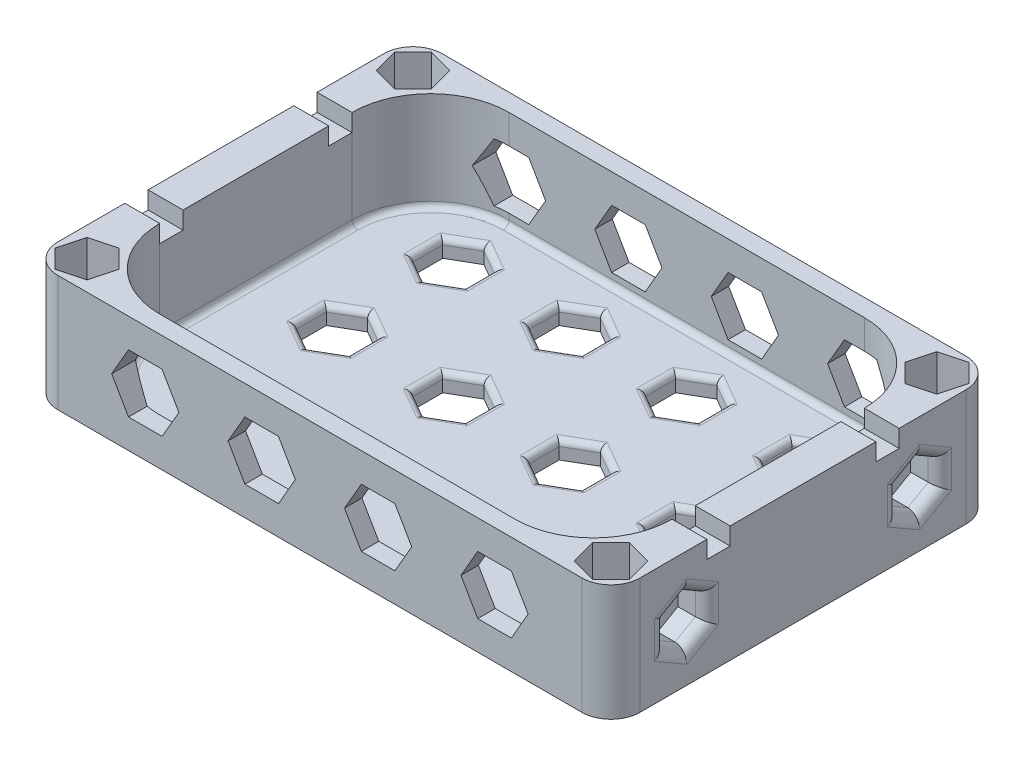
from build123d import *

# Parameters (mm, degrees)
BOSS_EXTRUDE7_DEPTH     = 20
BOSS_EXTRUDE9_DEPTH     = 3
CUT_EXTRUDE1_DEPTH      = 5
CUT_EXTRUDE2_DEPTH      = 5
FILLET3_R               = 2
FILLET4_R               = 1
SKETCH7_W               = 6
SKETCH7_H               = 4
CUT_EXTRUDE3_DEPTH      = 3
CUT_EXTRUDE4_DEPTH      = 122.474277112
CUT_EXTRUDE4_DEPTH_BACK = 122.474277112


with BuildPart() as part:
    # Sketch3 → Boss-Extrude7 (new body)
    with BuildSketch(Plane.XZ):
        with BuildLine():
            ThreePointArc((0, -28), (-1.464466094, -24.464466094), (-5, -23))
            ThreePointArc((-5, -23), (-6.913417162, -23.380602337), (-8.535533906, -24.464466094))
            Line((-8.535533906, -24.464466094), (-7.740038777, -25.259961223))
            Line((-7.740038779, -25.259961224), (-6.158076652, -23.677999097))
            Line((-6.158076652, -23.677999097), (-3.997076244, -24.257037411))
            Line((-3.997076244, -24.257037411), (-1.836075749, -24.836075749))
            Line((-1.836075749, -24.836075749), (-1.257037428, -26.99707618))
            Line((-1.257037428, -26.99707618), (-0.677999097, -29.158076652))
            Line((-0.677999097, -29.158076652), (-2.259961219, -30.740038773))
            Line((-2.259961223, -30.740038777), (-1.464466094, -31.535533906))
            ThreePointArc((-1.464466094, -31.535533906), (-0.380602337, -29.913417162), (0, -28))
        make_face()
        with BuildLine():
            Line((-7.740038777, -25.259961223), (-8.535533906, -24.464466094))
            ThreePointArc((-8.535533906, -24.464466094), (-8.732910174, -24.67353316), (-8.917942987, -24.893599712))
            ThreePointArc((-8.917942987, -24.893599712), (-9.721743054, -26.355268249), (-10, -28))
            ThreePointArc((-10, -28), (-8.535533906, -31.535533906), (-5, -33))
            ThreePointArc((-5, -33), (-3.086582838, -32.619397663), (-1.464466094, -31.535533906))
            Line((-1.464466094, -31.535533906), (-2.259961223, -30.740038777))
            Line((-2.259961219, -30.740038773), (-3.841923348, -32.322000903))
            Line((-3.841923348, -32.322000903), (-6.002923801, -31.742962577))
            Line((-6.002923801, -31.742962577), (-8.163924251, -31.163924251))
            Line((-8.163924251, -31.163924251), (-8.742962601, -29.002923708))
            Line((-8.742962601, -29.002923708), (-9.322000903, -26.841923348))
            Line((-9.322000903, -26.841923348), (-7.740038779, -25.259961224))
        make_face()
        with BuildLine():
            Line((0, -28), (0, -23))
            Line((0, -23), (-5, -23))
            ThreePointArc((-5, -23), (-1.464466094, -24.464466094), (0, -28))
        make_face()
        with BuildLine():
            Line((-5, -23), (-6, -23))
            Line((-6, -23), (-7.661030441, -23))
            ThreePointArc((-7.661030441, -23), (-8.091942003, -23.730311477), (-8.567907791, -24.432092209))
            Line((-8.567907791, -24.432092209), (-8.535533906, -24.464466094))
            ThreePointArc((-8.535533906, -24.464466094), (-6.913417162, -23.380602337), (-5, -23))
        make_face()
        with BuildLine():
            ThreePointArc((-8.917942987, -24.893599712), (-9.440797856, -25.51377538), (-10, -26.101387527))
            Line((-10, -26.101387527), (-10, -28))
            ThreePointArc((-10, -28), (-9.721743054, -26.355268249), (-8.917942987, -24.893599712))
        make_face()
        with BuildLine():
            Line((-8.535533906, -24.464466094), (-8.567907791, -24.432092209))
            ThreePointArc((-8.567907791, -24.432092209), (-8.740446841, -24.664725841), (-8.917942987, -24.893599712))
            ThreePointArc((-8.917942987, -24.893599712), (-8.732910174, -24.67353316), (-8.535533906, -24.464466094))
        make_face()
        with BuildLine():
            ThreePointArc((-5, -33), (-8.535533906, -31.535533906), (-10, -28))
            Line((-10, -28), (-10, -30))
            Line((-10, -30), (-10, -33))
            Line((-10, -33), (-5, -33))
        make_face()
        with BuildLine():
            Line((-10, -28), (-10, -26.101387527))
            ThreePointArc((-10, -26.101387527), (-14.356609245, -28.987317436), (-19.483314774, -30))
            Line((-19.483314774, -30), (-10, -30))
            Line((-10, -30), (-10, -28))
        make_face()
        Polygon((-10, -30), (-19.483314774, -30), (-80.516685226, -30), (-90, -30), (-90, -33), (-10, -33), align=None)
        Polygon((0, 0), (-6, 0), (-6, -16.516685226), (-6, -23), (-5, -23), (0, -23), align=None)
        with BuildLine():
            Line((-6, -23), (-6, -16.516685226))
            ThreePointArc((-6, -16.516685226), (-6.421857001, -19.863041177), (-7.661030441, -23))
            Line((-7.661030441, -23), (-6, -23))
        make_face()
        Polygon((-6, 16.516685226), (-6, 0), (0, 0), (0, 23), (-5, 23), (-6, 23), align=None)
        with BuildLine():
            ThreePointArc((-7.661030441, 23), (-6.421857001, 19.863041177), (-6, 16.516685226))
            Line((-6, 16.516685226), (-6, 23))
            Line((-6, 23), (-7.661030441, 23))
        make_face()
        with BuildLine():
            Line((-7.661030441, 23), (-6, 23))
            Line((-6, 23), (-5, 23))
            ThreePointArc((-5, 23), (-6.913417162, 23.380602337), (-8.535533906, 24.464466094))
            Line((-8.535533906, 24.464466094), (-8.567907791, 24.432092209))
            ThreePointArc((-8.567907791, 24.432092209), (-8.091942003, 23.730311477), (-7.661030441, 23))
        make_face()
        with BuildLine():
            Line((-10, 28), (-10, 26.101387527))
            ThreePointArc((-10, 26.101387527), (-9.440797857, 25.513775382), (-8.91794299, 24.893599716))
            ThreePointArc((-8.91794299, 24.893599716), (-9.721743055, 26.355268251), (-10, 28))
        make_face()
        with BuildLine():
            ThreePointArc((-19.483314774, 30), (-14.356609245, 28.987317436), (-10, 26.101387527))
            Line((-10, 26.101387527), (-10, 28))
            Line((-10, 28), (-10, 30))
            Line((-10, 30), (-19.483314774, 30))
        make_face()
        with BuildLine():
            ThreePointArc((-8.91794299, 24.893599716), (-8.740446842, 24.664725843), (-8.567907791, 24.432092209))
            Line((-8.567907791, 24.432092209), (-8.535533906, 24.464466094))
            ThreePointArc((-8.535533906, 24.464466094), (-8.732910175, 24.673533162), (-8.91794299, 24.893599716))
        make_face()
        with BuildLine():
            ThreePointArc((-8.91794299, 24.893599716), (-8.732910175, 24.673533162), (-8.535533906, 24.464466094))
            Line((-8.535533906, 24.464466094), (-7.740038777, 25.259961223))
            Line((-7.740038777, 25.259961223), (-9.322000903, 26.841923348))
            Line((-9.322000903, 26.841923348), (-8.742962597, 29.002923724))
            Line((-8.742962597, 29.002923724), (-8.163924251, 31.163924251))
            Line((-8.163924251, 31.163924251), (-6.002923796, 31.742962578))
            Line((-6.002923796, 31.742962578), (-3.841923348, 32.322000903))
            Line((-3.841923348, 32.322000903), (-2.259961222, 30.740038776))
            Line((-2.259961223, 30.740038777), (-1.464466094, 31.535533906))
            ThreePointArc((-1.464466094, 31.535533906), (-3.086582838, 32.619397663), (-5, 33))
            ThreePointArc((-5, 33), (-8.535533906, 31.535533906), (-10, 28))
            ThreePointArc((-10, 28), (-9.721743055, 26.355268251), (-8.91794299, 24.893599716))
        make_face()
        with BuildLine():
            ThreePointArc((-8.535533906, 24.464466094), (-6.913417162, 23.380602337), (-5, 23))
            ThreePointArc((-5, 23), (-1.464466094, 24.464466094), (0, 28))
            ThreePointArc((0, 28), (-0.380602337, 29.913417162), (-1.464466094, 31.535533906))
            Line((-1.464466094, 31.535533906), (-2.259961223, 30.740038777))
            Line((-2.259961222, 30.740038776), (-0.677999097, 29.158076652))
            Line((-0.677999097, 29.158076652), (-1.257037425, 26.997076192))
            Line((-1.257037425, 26.997076192), (-1.836075749, 24.836075749))
            Line((-1.836075749, 24.836075749), (-3.997076664, 24.257037299))
            Line((-3.997076664, 24.257037299), (-6.158076652, 23.677999097))
            Line((-6.158076652, 23.677999097), (-7.740038777, 25.259961223))
            Line((-7.740038777, 25.259961223), (-8.535533906, 24.464466094))
        make_face()
        with BuildLine():
            Line((-5, 23), (0, 23))
            Line((0, 23), (0, 28))
            ThreePointArc((0, 28), (-1.464466094, 24.464466094), (-5, 23))
        make_face()
        Polygon((-80.516685226, 30), (-19.483314774, 30), (-10, 30), (-10, 33), (-90, 33), (-90, 30), align=None)
        with BuildLine():
            Line((-10, 30), (-10, 28))
            ThreePointArc((-10, 28), (-8.535533906, 31.535533906), (-5, 33))
            Line((-5, 33), (-10, 33))
            Line((-10, 33), (-10, 30))
        make_face()
        with BuildLine():
            Line((-90, -30), (-80.516685226, -30))
            ThreePointArc((-80.516685226, -30), (-85.643390755, -28.987317436), (-90, -26.101387527))
            Line((-90, -26.101387527), (-90, -28))
            Line((-90, -28), (-90, -30))
        make_face()
        with BuildLine():
            Line((-90, -33), (-90, -30))
            Line((-90, -30), (-90, -28))
            ThreePointArc((-90, -28), (-91.464466094, -31.535533906), (-95, -33))
            Line((-95, -33), (-90, -33))
        make_face()
        with BuildLine():
            ThreePointArc((-95, -33), (-91.464466094, -31.535533906), (-90, -28))
            ThreePointArc((-90, -28), (-90.278256873, -26.355268458), (-91.082056738, -24.893600059))
            ThreePointArc((-91.082056738, -24.893600059), (-91.267089679, -24.673533326), (-91.464466094, -24.464466094))
            Line((-91.464466094, -24.464466094), (-92.259961223, -25.259961223))
            Line((-92.259961223, -25.259961223), (-90.677999097, -26.841923348))
            Line((-90.677999097, -26.841923348), (-91.257037439, -29.00292386))
            Line((-91.257037439, -29.00292386), (-91.836075749, -31.163924251))
            Line((-91.836075749, -31.163924251), (-93.997076192, -31.742962575))
            Line((-93.997076192, -31.742962575), (-96.158076652, -32.322000903))
            Line((-96.158076652, -32.322000903), (-97.740038777, -30.740038777))
            Line((-97.740038777, -30.740038777), (-98.535533906, -31.535533906))
            ThreePointArc((-98.535533906, -31.535533906), (-96.913417162, -32.619397663), (-95, -33))
        make_face()
        with BuildLine():
            Line((-92.259961223, -25.259961223), (-91.464466094, -24.464466094))
            ThreePointArc((-91.464466094, -24.464466094), (-93.086582815, -23.380602347), (-94.999999951, -23))
            ThreePointArc((-94.999999951, -23), (-98.535533888, -24.464466077), (-100, -28))
            ThreePointArc((-100, -28), (-99.619397663, -29.913417162), (-98.535533906, -31.535533906))
            Line((-98.535533906, -31.535533906), (-97.740038777, -30.740038777))
            Line((-97.740038777, -30.740038777), (-99.322000903, -29.158076652))
            Line((-99.322000903, -29.158076652), (-98.742962693, -26.997076632))
            Line((-98.742962693, -26.997076632), (-98.163924251, -24.836075749))
            Line((-98.163924251, -24.836075749), (-96.002923368, -24.257037307))
            Line((-96.002923368, -24.257037307), (-93.841923348, -23.677999097))
            Line((-93.841923348, -23.677999097), (-92.259961223, -25.259961223))
        make_face()
        with BuildLine():
            ThreePointArc((-100, -28), (-98.535533888, -24.464466077), (-94.999999951, -23))
            Line((-94.999999951, -23), (-100, -23))
            Line((-100, -23), (-100, -28))
        make_face()
        with BuildLine():
            ThreePointArc((-91.464466094, -24.464466094), (-91.267089679, -24.673533326), (-91.082056738, -24.893600059))
            ThreePointArc((-91.082056738, -24.893600059), (-91.259553025, -24.664726018), (-91.432092209, -24.432092209))
            Line((-91.432092209, -24.432092209), (-91.464466094, -24.464466094))
        make_face()
        with BuildLine():
            ThreePointArc((-91.432092209, -24.432092209), (-91.908057997, -23.730311477), (-92.338969559, -23))
            Line((-92.338969559, -23), (-94, -23))
            Line((-94, -23), (-94.999999951, -23))
            ThreePointArc((-94.999999951, -23), (-93.086582815, -23.380602347), (-91.464466094, -24.464466094))
            Line((-91.464466094, -24.464466094), (-91.432092209, -24.432092209))
        make_face()
        with BuildLine():
            Line((-90, -28), (-90, -26.101387527))
            ThreePointArc((-90, -26.101387527), (-90.559201997, -25.513775545), (-91.082056738, -24.893600059))
            ThreePointArc((-91.082056738, -24.893600059), (-90.278256873, -26.355268458), (-90, -28))
        make_face()
        Polygon((-94, 16.516685226), (-94, 23), (-95, 23), (-100, 23), (-100, -23), (-94.999999951, -23), (-94, -23), (-94, -16.516685226), align=None)
        with BuildLine():
            Line((-94, -23), (-92.338969559, -23))
            ThreePointArc((-92.338969559, -23), (-93.578142999, -19.863041177), (-94, -16.516685226))
            Line((-94, -16.516685226), (-94, -23))
        make_face()
        with BuildLine():
            ThreePointArc((-94, 16.516685226), (-93.578142999, 19.863041177), (-92.338969559, 23))
            Line((-92.338969559, 23), (-94, 23))
            Line((-94, 23), (-94, 16.516685226))
        make_face()
        with BuildLine():
            Line((-94, 23), (-92.338969559, 23))
            ThreePointArc((-92.338969559, 23), (-91.908057997, 23.730311477), (-91.432092209, 24.432092209))
            Line((-91.432092209, 24.432092209), (-91.464466094, 24.464466094))
            ThreePointArc((-91.464466094, 24.464466094), (-93.086582838, 23.380602337), (-95, 23))
            Line((-95, 23), (-94, 23))
        make_face()
        with BuildLine():
            ThreePointArc((-91.432092209, 24.432092209), (-91.259553334, 24.66472561), (-91.082057373, 24.893599258))
            ThreePointArc((-91.082057373, 24.893599258), (-91.267090019, 24.673532944), (-91.464466094, 24.464466094))
            Line((-91.464466094, 24.464466094), (-91.432092209, 24.432092209))
        make_face()
        with BuildLine():
            ThreePointArc((-91.082057373, 24.893599258), (-90.559202338, 25.513775164), (-90, 26.101387527))
            Line((-90, 26.101387527), (-90, 28))
            ThreePointArc((-90, 28), (-90.278257041, 26.355267975), (-91.082057373, 24.893599258))
        make_face()
        with BuildLine():
            ThreePointArc((-91.082057373, 24.893599258), (-90.278257041, 26.355267975), (-90, 28))
            ThreePointArc((-90, 28), (-91.464466094, 31.535533906), (-95, 33))
            ThreePointArc((-95, 33), (-96.913417162, 32.619397663), (-98.535533906, 31.535533906))
            Line((-98.535533906, 31.535533906), (-97.740038777, 30.740038777))
            Line((-97.740038777, 30.740038777), (-96.158076652, 32.322000903))
            Line((-96.158076652, 32.322000903), (-93.997076276, 31.742962597))
            Line((-93.997076276, 31.742962597), (-91.836075749, 31.163924251))
            Line((-91.836075749, 31.163924251), (-91.257037406, 29.002923736))
            Line((-91.257037406, 29.002923736), (-90.677999097, 26.841923348))
            Line((-90.677999097, 26.841923348), (-92.259961223, 25.259961223))
            Line((-92.259961223, 25.259961223), (-91.464466094, 24.464466094))
            ThreePointArc((-91.464466094, 24.464466094), (-91.267090019, 24.673532944), (-91.082057373, 24.893599258))
        make_face()
        with BuildLine():
            ThreePointArc((-95, 23), (-93.086582838, 23.380602337), (-91.464466094, 24.464466094))
            Line((-91.464466094, 24.464466094), (-92.259961223, 25.259961223))
            Line((-92.259961223, 25.259961223), (-93.841923348, 23.677999097))
            Line((-93.841923348, 23.677999097), (-96.00292408, 24.257037498))
            Line((-96.00292408, 24.257037498), (-98.163924251, 24.836075749))
            Line((-98.163924251, 24.836075749), (-98.742962597, 26.997076276))
            Line((-98.742962597, 26.997076276), (-99.322000903, 29.158076652))
            Line((-99.322000903, 29.158076652), (-97.740038777, 30.740038777))
            Line((-97.740038777, 30.740038777), (-98.535533906, 31.535533906))
            ThreePointArc((-98.535533906, 31.535533906), (-99.619397687, 29.913417102), (-100, 27.999999871))
            ThreePointArc((-100, 27.999999871), (-98.53553386, 24.464466048), (-95, 23))
        make_face()
        with BuildLine():
            Line((-100, 23), (-95, 23))
            ThreePointArc((-95, 23), (-98.53553386, 24.464466048), (-100, 27.999999871))
            Line((-100, 27.999999871), (-100, 23))
        make_face()
        with BuildLine():
            Line((-90, 28), (-90, 30))
            Line((-90, 30), (-90, 33))
            Line((-90, 33), (-95, 33))
            ThreePointArc((-95, 33), (-91.464466094, 31.535533906), (-90, 28))
        make_face()
        with BuildLine():
            ThreePointArc((-90, 26.101387527), (-85.643390755, 28.987317436), (-80.516685226, 30))
            Line((-80.516685226, 30), (-90, 30))
            Line((-90, 30), (-90, 28))
            Line((-90, 28), (-90, 26.101387527))
        make_face()
    extrude(amount=-BOSS_EXTRUDE7_DEPTH)

    # Sketch3<7> → Boss-Extrude9 (add)
    with BuildSketch(Plane.XZ):
        with BuildLine():
            Line((-6, -16.516685226), (-6, 0))
            Line((-6, 0), (-6, 16.516685226))
            ThreePointArc((-6, 16.516685226), (-9.949171464, 26.050828536), (-19.483314774, 30))
            Line((-19.483314774, 30), (-80.516685226, 30))
            ThreePointArc((-80.516685226, 30), (-90.050828536, 26.050828536), (-94, 16.516685226))
            Line((-94, 16.516685226), (-94, -16.516685226))
            ThreePointArc((-94, -16.516685226), (-90.050828536, -26.050828536), (-80.516685226, -30))
            Line((-80.516685226, -30), (-19.483314774, -30))
            ThreePointArc((-19.483314774, -30), (-9.949171464, -26.050828536), (-6, -16.516685226))
        make_face()
        Polygon((-84.5, -17.401923789), (-80, -14.803847577), (-75.5, -17.401923789), (-75.5, -22.598076211), (-80, -25.196152423), (-84.5, -22.598076211), align=None, mode=Mode.SUBTRACT)
        Polygon((-64.5, -17.401923789), (-60, -14.803847577), (-55.5, -17.401923789), (-55.5, -22.598076211), (-60, -25.196152423), (-64.5, -22.598076211), align=None, mode=Mode.SUBTRACT)
        Polygon((-75.5, 2.598076211), (-75.5, -2.598076211), (-80, -5.196152423), (-84.5, -2.598076211), (-84.5, 2.598076211), (-80, 5.196152423), align=None, mode=Mode.SUBTRACT)
        Polygon((-44.5, -17.401923789), (-40, -14.803847577), (-35.5, -17.401923789), (-35.5, -22.598076211), (-40, -25.196152423), (-44.5, -22.598076211), align=None, mode=Mode.SUBTRACT)
        Polygon((-24.5, -22.598076211), (-24.5, -17.401923789), (-20, -14.803847577), (-15.5, -17.401923789), (-15.5, -22.598076211), (-20, -25.196152423), align=None, mode=Mode.SUBTRACT)
        Polygon((-55.5, 2.598076211), (-55.5, -2.598076211), (-60, -5.196152423), (-64.5, -2.598076211), (-64.5, 2.598076211), (-60, 5.196152423), align=None, mode=Mode.SUBTRACT)
        Polygon((-75.5, 17.401923789), (-80, 14.803847577), (-84.5, 17.401923789), (-84.5, 22.598076211), (-80, 25.196152423), (-75.5, 22.598076211), align=None, mode=Mode.SUBTRACT)
        Polygon((-60, 14.803847577), (-64.5, 17.401923789), (-64.5, 22.598076211), (-60, 25.196152423), (-55.5, 22.598076211), (-55.5, 17.401923789), align=None, mode=Mode.SUBTRACT)
        Polygon((-35.5, 2.598076211), (-35.5, -2.598076211), (-40, -5.196152423), (-44.5, -2.598076211), (-44.5, 2.598076211), (-40, 5.196152423), align=None, mode=Mode.SUBTRACT)
        Polygon((-15.5, 2.598076211), (-15.5, 0), (-15.5, -2.598076211), (-20, -5.196152423), (-24.5, -2.598076211), (-24.5, 2.598076211), (-20, 5.196152423), align=None, mode=Mode.SUBTRACT)
        Polygon((-35.5, 22.598076211), (-35.5, 17.401923789), (-40, 14.803847577), (-44.5, 17.401923789), (-44.5, 22.598076211), (-40, 25.196152423), align=None, mode=Mode.SUBTRACT)
        Polygon((-15.5, 17.401923789), (-20, 14.803847577), (-24.5, 17.401923789), (-24.5, 22.598076211), (-20, 25.196152423), (-15.5, 22.598076211), align=None, mode=Mode.SUBTRACT)
    extrude(amount=-BOSS_EXTRUDE9_DEPTH)

    # Sketch5 → Cut-Extrude1 (cut)
    with BuildSketch(Plane.ZY.offset(100)):
        Polygon((-20, 5.458548116), (-16.5, 7.479274058), (-16.5, 11.520725942), (-20, 13.541451884), (-23.5, 11.520725942), (-23.5, 7.479274058), align=None)
        Polygon((23.5, 7.479274058), (23.5, 11.520725942), (20, 13.541451884), (16.5, 11.520725942), (16.5, 7.479274058), (20, 5.458548116), align=None)
    extrude(amount=-CUT_EXTRUDE1_DEPTH, mode=Mode.SUBTRACT)

    # Sketch6 → Cut-Extrude2 (cut)
    with BuildSketch(Plane(origin=(0, 0, 0), x_dir=(0, 0, -1), z_dir=(1, 0, 0))):
        Polygon((-20, 5.458548116), (-16.5, 7.479274058), (-16.5, 11.520725942), (-20, 13.541451884), (-23.5, 11.520725942), (-23.5, 7.479274058), align=None)
        Polygon((20, 5.458548116), (23.5, 7.479274058), (23.5, 11.520725942), (20, 13.541451884), (16.5, 11.520725942), (16.5, 7.479274058), align=None)
    extrude(amount=-CUT_EXTRUDE2_DEPTH, mode=Mode.SUBTRACT)

    # Fillet3
    fillet3_edges = [part.edges().sort_by_distance(p)[0] for p in [
        (-100, 6.468911087, -21.75),
        (-100, 6.468911087, -18.25),
        (-100, 9.5, -16.5),
        (-100, 12.531088913, -18.25),
        (-100, 12.531088913, -21.75),
        (-100, 9.5, -23.5),
        (-100, 6.468911087, 18.25),
        (-100, 6.468911087, 21.75),
        (-100, 9.5, 23.5),
        (-100, 12.531088913, 21.75),
        (-100, 12.531088913, 18.25),
        (-100, 9.5, 16.5),
        (0, 12.531088913, 18.25),
        (0, 12.531088913, 21.75),
        (0, 9.5, 23.5),
        (0, 6.468911087, 21.75),
        (0, 6.468911087, 18.25),
        (0, 9.5, 16.5),
        (0, 12.531088913, -21.75),
        (0, 12.531088913, -18.25),
        (0, 9.5, -16.5),
        (0, 6.468911087, -18.25),
        (0, 6.468911087, -21.75),
        (0, 9.5, -23.5),
    ]]
    fillet(fillet3_edges, radius=FILLET3_R)

    # Fillet4
    fillet4_edges = [part.edges().sort_by_distance(p)[0] for p in [
        (-50, 3, -30),
        (-90.050828536, 3, -26.050828536),
        (-94, 3, 0),
        (-37.75, 3, 3.897114317),
        (-42.25, 3, 3.897114317),
        (-44.5, 3, 0),
        (-42.25, 3, -3.897114317),
        (-37.75, 3, -3.897114317),
        (-35.5, 3, 0),
        (-62.25, 3, 16.102885683),
        (-57.75, 3, 16.102885683),
        (-55.5, 3, 20),
        (-57.75, 3, 23.897114317),
        (-62.25, 3, 23.897114317),
        (-64.5, 3, 20),
        (-75.5, 3, 0),
        (-77.75, 3, 3.897114317),
        (-82.25, 3, 3.897114317),
        (-84.5, 3, 0),
        (-82.25, 3, -3.897114317),
        (-77.75, 3, -3.897114317),
        (-62.25, 3, -3.897114317),
        (-57.75, 3, -3.897114317),
        (-55.5, 3, 0),
        (-57.75, 3, 3.897114317),
        (-62.25, 3, 3.897114317),
        (-64.5, 3, 0),
        (-42.25, 3, 16.102885683),
        (-37.75, 3, 16.102885683),
        (-35.5, 3, 20),
        (-37.75, 3, 23.897114317),
        (-42.25, 3, 23.897114317),
        (-44.5, 3, 20),
        (-37.75, 3, -16.102885683),
        (-42.25, 3, -16.102885683),
        (-44.5, 3, -20),
        (-42.25, 3, -23.897114317),
        (-37.75, 3, -23.897114317),
        (-35.5, 3, -20),
        (-22.25, 3, 3.897114317),
        (-24.5, 3, 0),
        (-22.25, 3, -3.897114317),
        (-17.75, 3, -3.897114317),
        (-15.5, 3, 0),
        (-17.75, 3, 3.897114317),
        (-90.050828536, 3, 26.050828536),
        (-50, 3, 30),
        (-9.949171464, 3, 26.050828536),
        (-6, 3, 0),
        (-9.949171464, 3, -26.050828536),
        (-22.25, 3, 16.102885683),
        (-17.75, 3, 16.102885683),
        (-15.5, 3, 20),
        (-17.75, 3, 23.897114317),
        (-22.25, 3, 23.897114317),
        (-24.5, 3, 20),
        (-77.75, 3, 16.102885683),
        (-75.5, 3, 20),
        (-77.75, 3, 23.897114317),
        (-82.25, 3, 23.897114317),
        (-84.5, 3, 20),
        (-82.25, 3, 16.102885683),
        (-77.75, 3, -16.102885683),
        (-82.25, 3, -16.102885683),
        (-84.5, 3, -20),
        (-82.25, 3, -23.897114317),
        (-77.75, 3, -23.897114317),
        (-75.5, 3, -20),
        (-22.25, 3, -16.102885683),
        (-24.5, 3, -20),
        (-22.25, 3, -23.897114317),
        (-17.75, 3, -23.897114317),
        (-15.5, 3, -20),
        (-17.75, 3, -16.102885683),
        (-57.75, 3, -16.102885683),
        (-62.25, 3, -16.102885683),
        (-64.5, 3, -20),
        (-62.25, 3, -23.897114317),
        (-57.75, 3, -23.897114317),
        (-55.5, 3, -20),
    ]]
    fillet(fillet4_edges, radius=FILLET4_R)

    # Sketch7 → Cut-Extrude3 (cut)
    with BuildSketch(Plane(origin=(0, 20, 0), x_dir=(1, 0, 0), z_dir=(0, 1, 0))):
        with Locations((-97, 14.516685226)):
            Rectangle(SKETCH7_W, SKETCH7_H)
        with Locations((-97, -14.516685226)):
            Rectangle(SKETCH7_W, SKETCH7_H)
        with Locations((-3, 14.516685226)):
            Rectangle(SKETCH7_W, SKETCH7_H)
        with Locations((-3, -14.516685226)):
            Rectangle(SKETCH7_W, SKETCH7_H)
    extrude(amount=-CUT_EXTRUDE3_DEPTH, mode=Mode.SUBTRACT)

    # Sketch8 → Cut-Extrude4 (cut, two sides: drawn at the far end of the back side and taken through both)
    with BuildSketch(Plane.XY.offset(33).offset(-CUT_EXTRUDE4_DEPTH_BACK)):
        Polygon((-85.773502692, 10), (-82.886751346, 5), (-77.113248654, 5), (-74.226497308, 10), (-77.113248654, 15), (-82.886751346, 15), align=None)
        Polygon((-65.773502692, 10), (-62.886751346, 5), (-57.113248654, 5), (-54.226497308, 10), (-57.113248654, 15), (-62.886751346, 15), align=None)
        Polygon((-45.773502692, 10), (-42.886751346, 5), (-37.113248654, 5), (-34.226497308, 10), (-37.113248654, 15), (-42.886751346, 15), align=None)
        Polygon((-25.773502692, 10), (-22.886751346, 5), (-17.113248654, 5), (-14.226497308, 10), (-17.113248654, 15), (-22.886751346, 15), align=None)
    extrude(amount=CUT_EXTRUDE4_DEPTH + CUT_EXTRUDE4_DEPTH_BACK, mode=Mode.SUBTRACT)


solid = part.part
